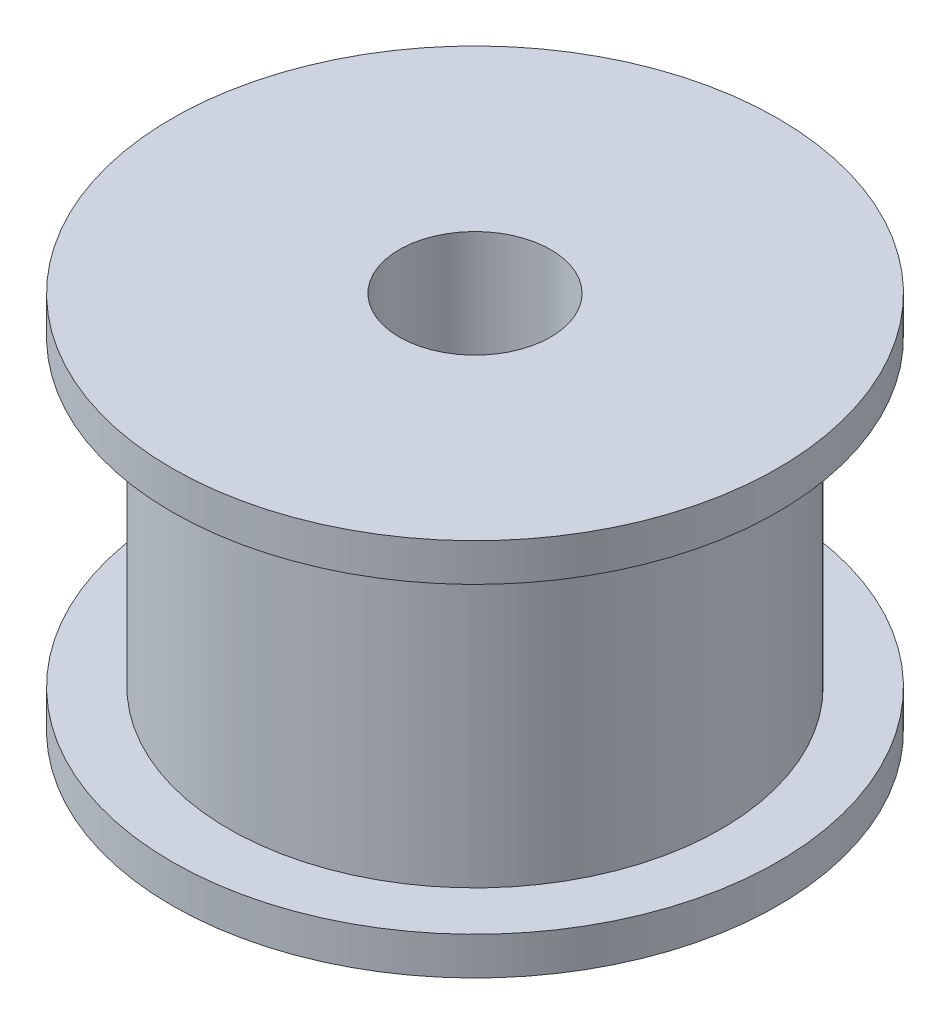
from build123d import *

# Parameters (mm, degrees)
SKETCH2_W          = 6.5
SKETCH2_H          = 8
SKETCH2_W_2        = 8
SKETCH2_H_2        = 1
SKETCH4_R          = 2
CUT_EXTRUDE1_DEPTH = 10


with BuildPart() as part:
    # Sketch2 → Revolve1 (revolve)
    with BuildSketch(Plane.XY, mode=Mode.PRIVATE) as revolve1_sk:
        Polygon((-6.5, 8), (0, 8), (0, 9), (-8, 9), (-8, 8), align=None)
        with Locations((-3.25, 4)):
            Rectangle(SKETCH2_W, SKETCH2_H)
        with Locations((-4, -0.5)):
            Rectangle(SKETCH2_W_2, SKETCH2_H_2)
    revolve(revolve1_sk.sketch.rotate(Axis((0, 0, 0), (0, 1, 0)), 270), axis=Axis((0, 0, 0), (0, 1, 0)))

    # Sketch4 → Cut-Extrude1 (cut)
    with BuildSketch(Plane(origin=(0, 9, 0), x_dir=(1, 0, 0), z_dir=(0, 1, 0))):
        with Locations(Location((0, 0, 0), (0, 0, 270))):
            Circle(SKETCH4_R)
    extrude(amount=-CUT_EXTRUDE1_DEPTH, mode=Mode.SUBTRACT)


solid = part.part
